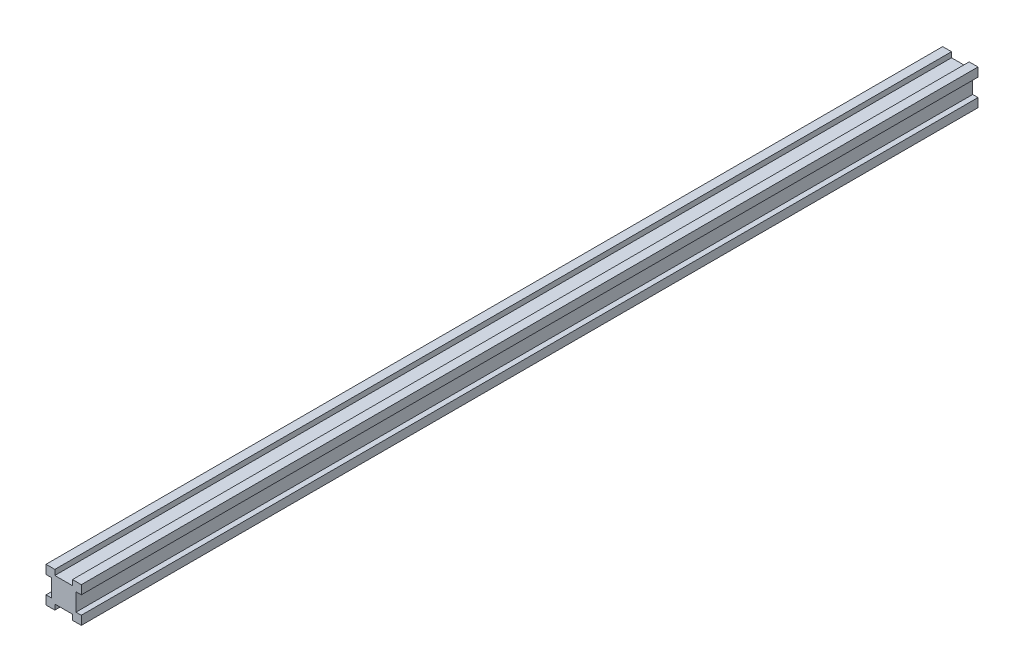
from build123d import *

# Parameters (mm, degrees)
EXTRUDE_1_DEPTH = 254


with BuildPart() as part:
    # 草图1 → 凸台-拉伸1 (new, symmetric)
    with BuildSketch(Plane.XY):
        Polygon((-5, 7), (-5, 10), (-10, 10), (-10, 5), (-7, 5), (-7, -5), (-10, -5), (-10, -10), (-5, -10), (-5, -7), (5, -7), (5, -10), (10, -10), (10, -5), (7, -5), (7, 5), (10, 5), (10, 10), (5, 10), (5, 7), align=None)
    extrude(amount=EXTRUDE_1_DEPTH, both=True)


solid = part.part
